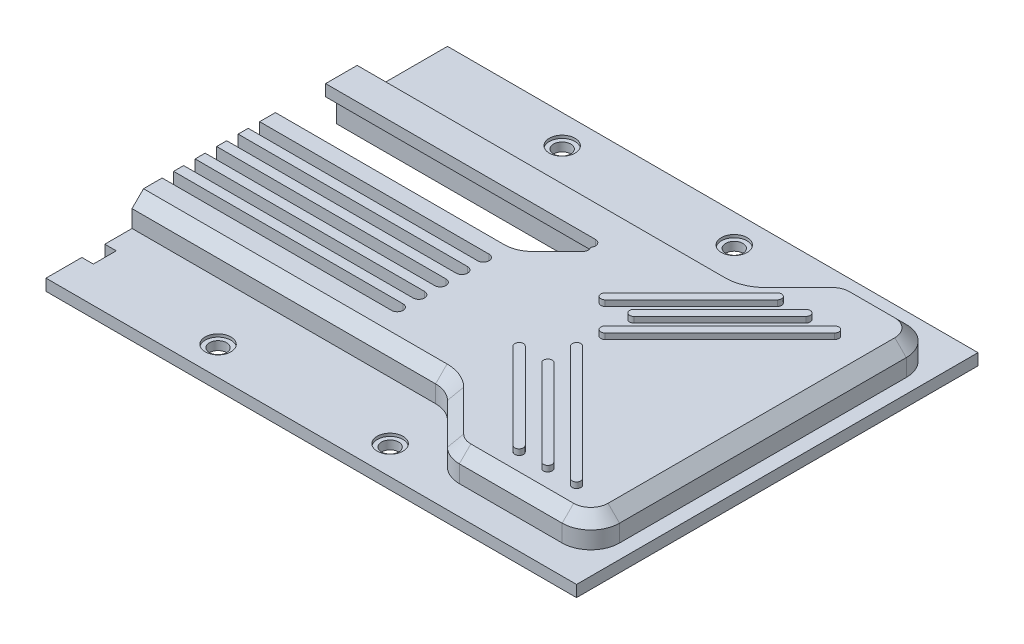
from build123d import *

# Parameters (mm, degrees)
SKETCH1_W               = 190
SKETCH1_H               = 140
BOSS_EXTRUDE1_DEPTH     = 4
BOSS_EXTRUDE2_DEPTH     = 10
CUT_EXTRUDE3_DEPTH      = 237.423349101
CUT_EXTRUDE3_DEPTH_BACK = 237.423349101
CUT_EXTRUDE6_DEPTH      = 10
SKETCH6_W               = 100
SKETCH6_H               = 70.6
CUT_EXTRUDE8_DEPTH      = 10
SKETCH7_W               = 5
SKETCH7_H               = 140
CUT_EXTRUDE9_DEPTH      = 10
BOSS_EXTRUDE3_DEPTH     = 2
SKETCH10_W              = 4
SKETCH10_H              = 8
CUT_EXTRUDE11_DEPTH     = 10
SKETCH11_R              = 3
CUT_EXTRUDE12_DEPTH     = 10
SKETCH13_R              = 4.5
CUT_EXTRUDE16_DEPTH     = 1
CHAMFER1_SIZE           = 4


with BuildPart() as part:
    # Sketch1 → Boss-Extrude1 (new body)
    with BuildSketch(Plane(origin=(0, 0, 0), x_dir=(1, 0, 0), z_dir=(0, 1, 0))):
        with Locations((95, 70)):
            Rectangle(SKETCH1_W, SKETCH1_H)
    extrude(amount=BOSS_EXTRUDE1_DEPTH)

    # Sketch2 → Boss-Extrude2 (add)
    with BuildSketch(Plane(origin=(0, 4, 0), x_dir=(1, 0, 0), z_dir=(0, 1, 0))):
        with BuildLine():
            Line((147.071067812, 127.071067812), (135.428932188, 115.428932188))
            ThreePointArc((135.428932188, 115.428932188), (132.1846987, 113.261204675), (128.357864376, 112.5))
            Line((128.357864376, 112.5), (0, 112.5))
            Line((0, 112.5), (0, 97.5))
            Line((0, 97.5), (94.092172608, 97.5))
            ThreePointArc((94.092172608, 97.5), (95.939931673, 96.265366865), (95.50638617, 94.085786438))
            Line((95.50638617, 94.085786438), (86.849531921, 85.428932188))
            ThreePointArc((86.849531921, 85.428932188), (83.605298432, 83.261204675), (79.778464109, 82.5))
            Line((79.778464109, 82.5), (30.446951372, 82.5))
            Line((30.446951372, 82.5), (0, 82.5))
            Line((0, 82.5), (0, 74.5))
            Line((0, 74.5), (80, 74.5))
            ThreePointArc((80, 74.5), (82, 72.5), (80, 70.5))
            Line((80, 70.5), (0, 70.5))
            Line((0, 70.5), (0, 67))
            Line((0, 67), (80, 67))
            ThreePointArc((80, 67), (82, 65), (80, 63))
            Line((80, 63), (0, 63))
            Line((0, 63), (0, 59.5))
            Line((0, 59.5), (80, 59.5))
            ThreePointArc((80, 59.5), (82, 57.5), (80, 55.5))
            Line((80, 55.5), (0, 55.5))
            Line((0, 55.5), (0, 52))
            Line((0, 52), (80, 52))
            ThreePointArc((80, 52), (82, 50), (80, 48))
            Line((80, 48), (0, 48))
            Line((0, 48), (0, 44.5))
            Line((0, 44.5), (80, 44.5))
            ThreePointArc((80, 44.5), (82, 42.5), (80, 40.5))
            Line((80, 40.5), (0, 40.5))
            Line((0, 40.5), (0, 30))
            Line((0, 30), (105.857864376, 30))
            ThreePointArc((105.857864376, 30), (109.6846987, 29.238795325), (112.928932188, 27.071067812))
            Line((112.928932188, 27.071067812), (127.071067812, 12.928932188))
            ThreePointArc((127.071067812, 12.928932188), (130.3153013, 10.761204675), (134.142135624, 10))
            Line((134.142135624, 10), (170, 10))
            ThreePointArc((170, 10), (177.071067812, 12.928932188), (180, 20))
            Line((180, 20), (180, 120))
            ThreePointArc((180, 120), (177.071067812, 127.071067812), (170, 130))
            Line((170, 130), (154.142135624, 130))
            ThreePointArc((154.142135624, 130), (150.3153013, 129.238795325), (147.071067812, 127.071067812))
        make_face()
    extrude(amount=BOSS_EXTRUDE2_DEPTH)

    # Sketch4 → Cut-Extrude3 (cut, two sides: drawn at the far end of the back side and taken through both)
    with BuildSketch(Plane(origin=(0, 0, 0), x_dir=(1, 0, 0), z_dir=(0, 1, 0)).offset(-CUT_EXTRUDE3_DEPTH_BACK)):
        with BuildLine():
            Line((94.092172608, 95), (0, 95))
            Line((0, 95), (0, 80))
            Line((0, 80), (30.446951372, 80))
            Line((30.446951372, 80), (79.778464109, 80))
            ThreePointArc((79.778464109, 80), (83.605298432, 80.761204675), (86.849531921, 82.928932188))
            Line((86.849531921, 82.928932188), (95.50638617, 91.585786438))
            ThreePointArc((95.50638617, 91.585786438), (95.939931673, 93.765366865), (94.092172608, 95))
        make_face()
    extrude(amount=CUT_EXTRUDE3_DEPTH + CUT_EXTRUDE3_DEPTH_BACK, mode=Mode.SUBTRACT)

    # Sketch5 → Cut-Extrude6 (cut)
    with BuildSketch(Plane(origin=(0, 0, 0), x_dir=(1, 0, 0), z_dir=(0, 1, 0))):
        with BuildLine():
            Line((-80, 70.5), (80, 70.5))
            ThreePointArc((80, 70.5), (82, 72.5), (80, 74.5))
            Line((80, 74.5), (-80, 74.5))
            ThreePointArc((-80, 74.5), (-82, 72.5), (-80, 70.5))
        make_face()
        with BuildLine():
            Line((80, 63), (-80, 63))
            ThreePointArc((-80, 63), (-82, 65), (-80, 67))
            Line((-80, 67), (80, 67))
            ThreePointArc((80, 67), (82, 65), (80, 63))
        make_face()
        with BuildLine():
            Line((-80, 55.5), (80, 55.5))
            ThreePointArc((80, 55.5), (82, 57.5), (80, 59.5))
            Line((80, 59.5), (-80, 59.5))
            ThreePointArc((-80, 59.5), (-82, 57.5), (-80, 55.5))
        make_face()
        with BuildLine():
            Line((-80, 48), (80, 48))
            ThreePointArc((80, 48), (82, 50), (80, 52))
            Line((80, 52), (-80, 52))
            ThreePointArc((-80, 52), (-82, 50), (-80, 48))
        make_face()
        with BuildLine():
            Line((-80, 40.5), (80, 40.5))
            ThreePointArc((80, 40.5), (82, 42.5), (80, 44.5))
            Line((80, 44.5), (-80, 44.5))
            ThreePointArc((-80, 44.5), (-82, 42.5), (-80, 40.5))
        make_face()
        with BuildLine():
            Line((-80, 33), (80, 33))
            ThreePointArc((80, 33), (82, 35), (80, 37))
            Line((80, 37), (-80, 37))
            ThreePointArc((-80, 37), (-82, 35), (-80, 33))
        make_face()
    extrude(amount=CUT_EXTRUDE6_DEPTH, mode=Mode.SUBTRACT)

    # Sketch6 → Cut-Extrude8 (cut)
    with BuildSketch(Plane(origin=(0, 0, 0), x_dir=(1, 0, 0), z_dir=(0, 1, 0))):
        with Locations((50, 65.958937639)):
            Rectangle(SKETCH6_W, SKETCH6_H)
    extrude(amount=CUT_EXTRUDE8_DEPTH, mode=Mode.SUBTRACT)

    # Sketch7 → Cut-Extrude9 (cut)
    with BuildSketch(Plane(origin=(0, 4, 0), x_dir=(1, 0, 0), z_dir=(0, 1, 0))):
        with Locations((187.5, 70)):
            Rectangle(SKETCH7_W, SKETCH7_H)
    extrude(amount=-CUT_EXTRUDE9_DEPTH, mode=Mode.SUBTRACT)

    # Sketch9 → Boss-Extrude3 (add)
    with BuildSketch(Plane(origin=(0, 14, 0), x_dir=(1, 0, 0), z_dir=(0, 1, 0))):
        with BuildLine():
            Line((153.939339828, 18.939339828), (123.939339828, 48.939339828))
            ThreePointArc((123.939339828, 48.939339828), (123.939339828, 51.060660172), (126.060660172, 51.060660172))
            Line((126.060660172, 51.060660172), (156.060660172, 21.060660172))
            ThreePointArc((156.060660172, 21.060660172), (156.060660172, 18.939339828), (153.939339828, 18.939339828))
        make_face()
        with BuildLine():
            Line((126.060660172, 61.060660172), (166.060660172, 21.060660172))
            ThreePointArc((166.060660172, 21.060660172), (166.060660172, 18.939339828), (163.939339828, 18.939339828))
            Line((163.939339828, 18.939339828), (123.939339828, 58.939339828))
            ThreePointArc((123.939339828, 58.939339828), (123.939339828, 61.060660172), (126.060660172, 61.060660172))
        make_face()
        with BuildLine():
            Line((143.939339828, 18.939339828), (113.939339828, 48.939339828))
            ThreePointArc((113.939339828, 48.939339828), (113.939339828, 51.060660172), (116.060660172, 51.060660172))
            Line((116.060660172, 51.060660172), (146.060660172, 21.060660172))
            ThreePointArc((146.060660172, 21.060660172), (146.060660172, 18.939339828), (143.939339828, 18.939339828))
        make_face()
        with BuildLine():
            Line((143.939339828, 111.060660172), (113.939339828, 81.060660172))
            ThreePointArc((113.939339828, 81.060660172), (113.939339828, 78.939339828), (116.060660172, 78.939339828))
            Line((116.060660172, 78.939339828), (146.060660172, 108.939339828))
            ThreePointArc((146.060660172, 108.939339828), (146.060660172, 111.060660172), (143.939339828, 111.060660172))
        make_face()
        with BuildLine():
            Line((153.939339828, 111.060660172), (123.939339828, 81.060660172))
            ThreePointArc((123.939339828, 81.060660172), (123.939339828, 78.939339828), (126.060660172, 78.939339828))
            Line((126.060660172, 78.939339828), (156.060660172, 108.939339828))
            ThreePointArc((156.060660172, 108.939339828), (156.060660172, 111.060660172), (153.939339828, 111.060660172))
        make_face()
        with BuildLine():
            Line((126.060660172, 68.939339828), (166.060660172, 108.939339828))
            ThreePointArc((166.060660172, 108.939339828), (166.060660172, 111.060660172), (163.939339828, 111.060660172))
            Line((163.939339828, 111.060660172), (123.939339828, 71.060660172))
            ThreePointArc((123.939339828, 71.060660172), (123.939339828, 68.939339828), (126.060660172, 68.939339828))
        make_face()
    extrude(amount=BOSS_EXTRUDE3_DEPTH)

    # Sketch10 → Cut-Extrude11 (cut)
    with BuildSketch(Plane(origin=(0, 4, 0), x_dir=(1, 0, 0), z_dir=(0, 1, 0))):
        with Locations((2, 16.5)):
            Rectangle(SKETCH10_W, SKETCH10_H)
    extrude(amount=-CUT_EXTRUDE11_DEPTH, mode=Mode.SUBTRACT)

    # Sketch11 → Cut-Extrude12 (cut)
    with BuildSketch(Plane(origin=(0, 4, 0), x_dir=(1, 0, 0), z_dir=(0, 1, 0))):
        with Locations(Location((50, 10, 0), (0, 0, 270))):
            Circle(SKETCH11_R)
        with Locations(Location((110, 10, 0), (0, 0, 270))):
            Circle(SKETCH11_R)
        with Locations(Location((50, 130, 0), (0, 0, 90))):
            Circle(SKETCH11_R)
        with Locations(Location((110, 130, 0), (0, 0, 90))):
            Circle(SKETCH11_R)
    extrude(amount=-CUT_EXTRUDE12_DEPTH, mode=Mode.SUBTRACT)

    # Sketch13 → Cut-Extrude16 (cut)
    with BuildSketch(Plane(origin=(0, 4, 0), x_dir=(1, 0, 0), z_dir=(0, 1, 0))):
        with Locations(Location((50, 10, 0), (0, 0, 270))):
            Circle(SKETCH13_R)
        with Locations(Location((110, 10, 0), (0, 0, 270))):
            Circle(SKETCH13_R)
        with Locations(Location((50, 130, 0), (0, 0, 90))):
            Circle(SKETCH13_R)
        with Locations(Location((110, 130, 0), (0, 0, 90))):
            Circle(SKETCH13_R)
    extrude(amount=-CUT_EXTRUDE16_DEPTH, mode=Mode.SUBTRACT)

    # Chamfer1
    chamfer1_edges = [part.edges().sort_by_distance(p)[0] for p in [
        (52.928932188, 14, -30),
        (120, 14, -20),
        (152.071067812, 14, -10),
        (177.071067812, 14, -12.928932188),
        (180, 14, -70),
        (177.071067812, 14, -127.071067812),
        (162.071067812, 14, -130),
        (150.3153013, 14, -129.238795325),
        (141.25, 14, -121.25),
        (109.6846987, 14, -29.238795325),
        (130.3153013, 14, -10.761204675),
        (132.1846987, 14, -113.261204675),
        (64.178932188, 14, -112.5),
    ]]
    chamfer(chamfer1_edges, length=CHAMFER1_SIZE)


solid = part.part
